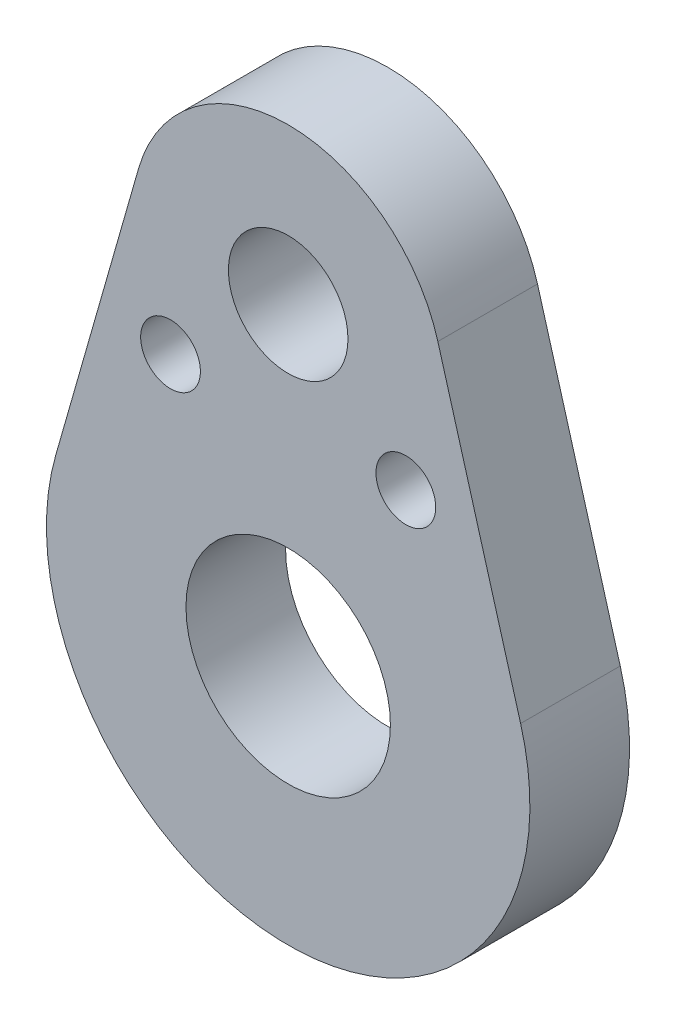
from build123d import *

# Parameters (mm, degrees)
ESQUISSE1_R        = 5.129898749
ESQUISSE1_R_2      = 3
ESQUISSE1_R_3      = 1.5
BOSS_EXTRU_1_DEPTH = 5


with BuildPart() as part:
    # Esquisse1 → Boss.-Extru.1 (new body)
    with BuildSketch(Plane.XY):
        with BuildLine():
            Line((7.511654648, 17.86120118), (11.664614312, 3.334802688))
            ThreePointArc((11.664614312, 3.334802688), (0, -12.131946918), (-11.664614312, 3.334802688))
            Line((-11.664614312, 3.334802688), (-7.511654648, 17.86120118))
            ThreePointArc((-7.511654648, 17.86120118), (0, 23.526292848), (7.511654648, 17.86120118))
        make_face()
        Circle(ESQUISSE1_R, mode=Mode.SUBTRACT)
        with Locations((0, 15.713690304)):
            Circle(ESQUISSE1_R_2, mode=Mode.SUBTRACT)
        with Locations((5.904785434, 10.598001934)):
            Circle(ESQUISSE1_R_3, mode=Mode.SUBTRACT)
        with Locations((-5.904785434, 10.598001934)):
            Circle(ESQUISSE1_R_3, mode=Mode.SUBTRACT)
    extrude(amount=BOSS_EXTRU_1_DEPTH)


solid = part.part
